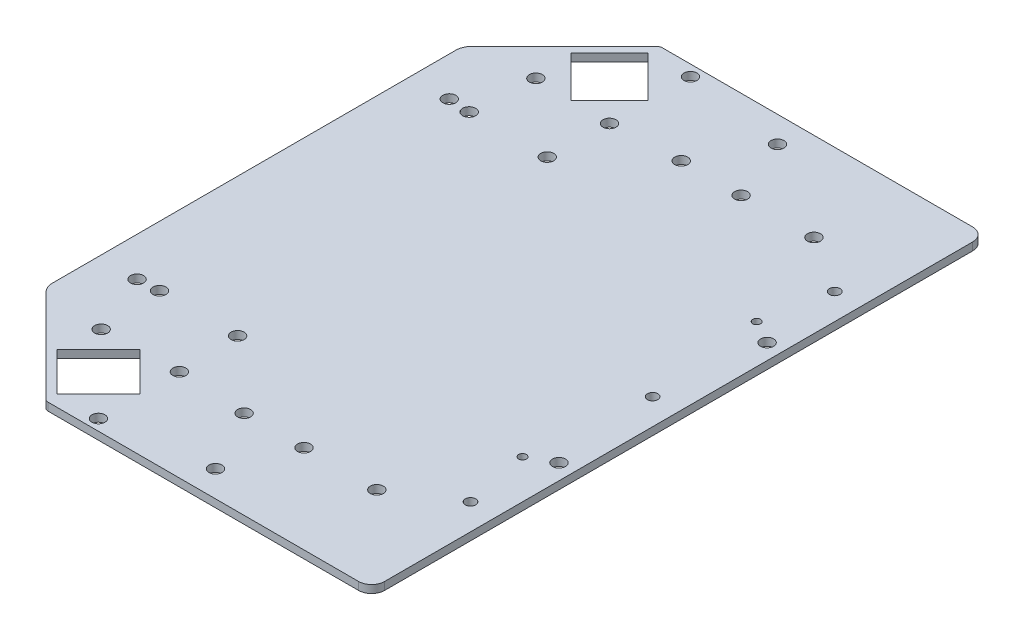
from build123d import *

# Parameters (mm, degrees)
SKETCH_1_R      = 2.5
SKETCH_1_R_2    = 1.5
SKETCH_1_R_3    = 2
EXTRUDE_1_DEPTH = 3


with BuildPart() as part:
    # 草图1 → 凸台-拉伸1 (new body)
    with BuildSketch(Plane.XZ):
        with BuildLine():
            Line((-154.308657865, -118), (-35, -118))
            ThreePointArc((-35, -118), (-31.464466094, -116.535533906), (-30, -113))
            Line((-30, -113), (-30, 113))
            ThreePointArc((-30, 113), (-31.464466094, 116.535533906), (-35, 118))
            Line((-35, 118), (-154.308657865, 118))
            ThreePointArc((-154.308657865, 118), (-155.07402473, 117.847759065), (-155.722871427, 117.414213562))
            Line((-155.722871427, 117.414213562), (-191.379725677, 81.757359313))
            ThreePointArc((-191.379725677, 81.757359313), (-192.680362185, 79.81081922), (-193.13708499, 77.514718626))
            Line((-193.13708499, 77.514718626), (-193.13708499, -77.514718626))
            ThreePointArc((-193.13708499, -77.514718626), (-192.680362185, -79.81081922), (-191.379725677, -81.757359313))
            Line((-191.379725677, -81.757359313), (-155.722871427, -117.414213562))
            ThreePointArc((-155.722871427, -117.414213562), (-155.07402473, -117.847759065), (-154.308657865, -118))
        make_face()
        with Locations(Location((-140, 59.5, 0), (0, 0, 270))):
            Circle(SKETCH_1_R, mode=Mode.SUBTRACT)
        with Locations(Location((-170, -59.5, 0), (0, 0, 270))):
            Circle(SKETCH_1_R, mode=Mode.SUBTRACT)
        with Locations(Location((-140, -59.5, 0), (0, 0, 270))):
            Circle(SKETCH_1_R, mode=Mode.SUBTRACT)
        with Locations(Location((-178.13708499, 60, 0), (0, 0, 270))):
            Circle(SKETCH_1_R, mode=Mode.SUBTRACT)
        with Locations(Location((-178.13708499, -60, 0), (0, 0, 270))):
            Circle(SKETCH_1_R, mode=Mode.SUBTRACT)
        with Locations(Location((-168.388347648, -83.535533906, 0), (0, 0, 270))):
            Circle(SKETCH_1_R, mode=Mode.SUBTRACT)
        with Locations(Location((-168.388347648, 83.535533906, 0), (0, 0, 270))):
            Circle(SKETCH_1_R, mode=Mode.SUBTRACT)
        with Locations(Location((-45, -45, 0), (0, 0, 270))):
            Circle(SKETCH_1_R_2, mode=Mode.SUBTRACT)
        with Locations(Location((-45, 45, 0), (0, 0, 270))):
            Circle(SKETCH_1_R_2, mode=Mode.SUBTRACT)
        with Locations(Location((-36, -40, 0), (0, 0, 270))):
            Circle(SKETCH_1_R, mode=Mode.SUBTRACT)
        with Locations(Location((-36, 40, 0), (0, 0, 270))):
            Circle(SKETCH_1_R, mode=Mode.SUBTRACT)
        with Locations(Location((-62, 84, 0), (0, 0, 270))):
            Circle(SKETCH_1_R, mode=Mode.SUBTRACT)
        with Locations(Location((-90, 84, 0), (0, 0, 270))):
            Circle(SKETCH_1_R, mode=Mode.SUBTRACT)
        with Locations(Location((-113, 84, 0), (0, 0, 270))):
            Circle(SKETCH_1_R, mode=Mode.SUBTRACT)
        with Locations(Location((-62, -84, 0), (0, 0, 270))):
            Circle(SKETCH_1_R, mode=Mode.SUBTRACT)
        with Locations(Location((-90, -84, 0), (0, 0, 270))):
            Circle(SKETCH_1_R, mode=Mode.SUBTRACT)
        with Locations(Location((-113, -84, 0), (0, 0, 270))):
            Circle(SKETCH_1_R, mode=Mode.SUBTRACT)
        with Locations(Location((-100, -108, 0), (0, 0, 270))):
            Circle(SKETCH_1_R, mode=Mode.SUBTRACT)
        with Locations(Location((-100, 108, 0), (0, 0, 270))):
            Circle(SKETCH_1_R, mode=Mode.SUBTRACT)
        with Locations(Location((-139.220192924, 113.764348802, 0), (0, 0, 270))):
            Circle(SKETCH_1_R, mode=Mode.SUBTRACT)
        with Locations(Location((-139.220192924, 82.651650429, 0), (0, 0, 270))):
            Circle(SKETCH_1_R, mode=Mode.SUBTRACT)
        with Locations(Location((-139.220192924, -113.764348802, 0), (0, 0, 270))):
            Circle(SKETCH_1_R, mode=Mode.SUBTRACT)
        with Locations(Location((-139.220192924, -82.651650429, 0), (0, 0, 270))):
            Circle(SKETCH_1_R, mode=Mode.SUBTRACT)
        with Locations(Location((-40, 70, 0), (0, 0, 270))):
            Circle(SKETCH_1_R_3, mode=Mode.SUBTRACT)
        with Locations(Location((-40, -70, 0), (0, 0, 270))):
            Circle(SKETCH_1_R_3, mode=Mode.SUBTRACT)
        with Locations(Location((-40, 0, 0), (0, 0, 270))):
            Circle(SKETCH_1_R_3, mode=Mode.SUBTRACT)
        with Locations(Location((-170, 59.5, 0), (0, 0, 270))):
            Circle(SKETCH_1_R, mode=Mode.SUBTRACT)
        Polygon((-170.156114601, 98.738329701), (-155.306872196, 113.587572106), (-139.39696962, 97.67766953), (-154.246212025, 82.828427125), align=None, mode=Mode.SUBTRACT)
        Polygon((-170.156114601, -98.738329701), (-154.246212025, -82.828427125), (-139.39696962, -97.67766953), (-155.306872196, -113.587572106), align=None, mode=Mode.SUBTRACT)
    extrude(amount=-EXTRUDE_1_DEPTH)


solid = part.part
